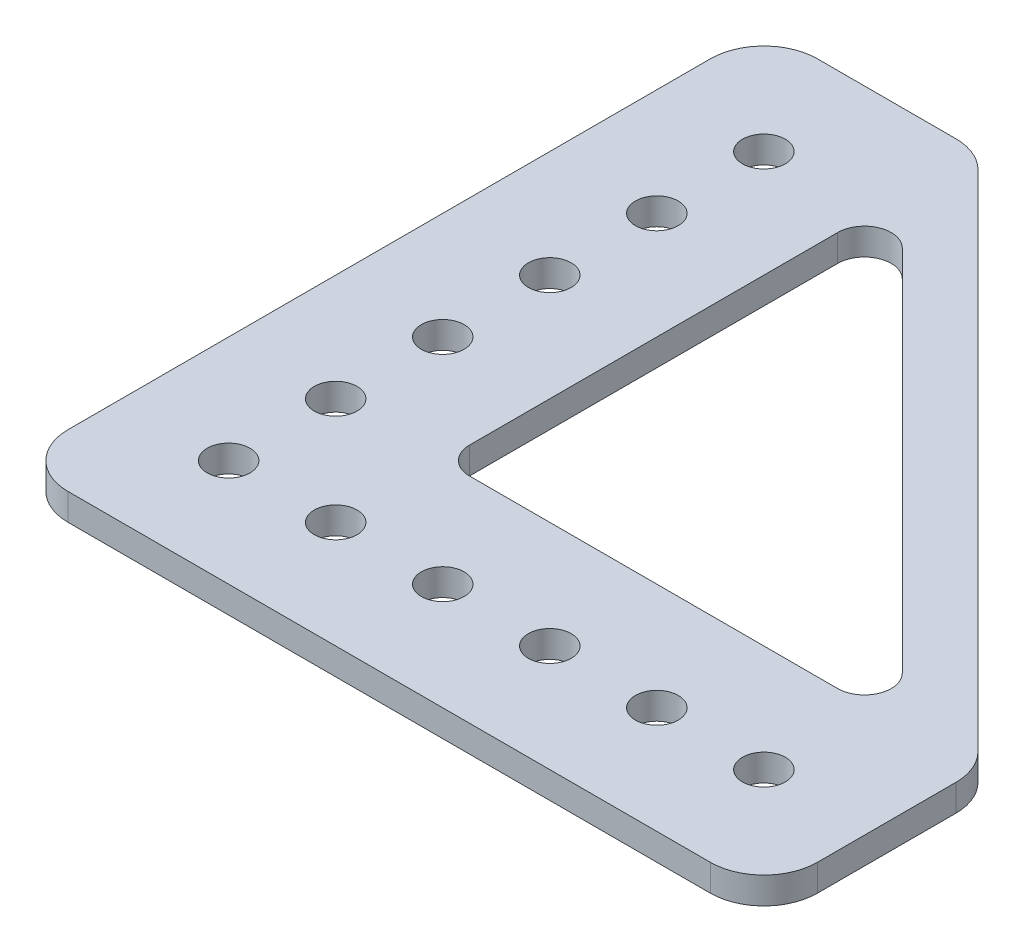
from build123d import *

# Parameters (mm, degrees)
SKETCH1_R           = 2.54
BOSS_EXTRUDE1_DEPTH = 3.175
FILLET1_R           = 6.35
FILLET2_R           = 3.175


with BuildPart() as part:
    # Sketch1 → Boss-Extrude1 (new body)
    with BuildSketch(Plane(origin=(0, 0, 0), x_dir=(1, 0, 0), z_dir=(0, 1, 0))):
        Polygon((0, 0), (0, 88.9), (25.4, 88.9), (88.9, 25.4), (88.9, 0), align=None)
        with Locations(Location((12.7, 12.7, 0), (0, 0, 270))):
            Circle(SKETCH1_R, mode=Mode.SUBTRACT)
        with Locations(Location((25.4, 12.7, 0), (0, 0, 270))):
            Circle(SKETCH1_R, mode=Mode.SUBTRACT)
        with Locations(Location((38.1, 12.7, 0), (0, 0, 270))):
            Circle(SKETCH1_R, mode=Mode.SUBTRACT)
        with Locations(Location((50.8, 12.7, 0), (0, 0, 270))):
            Circle(SKETCH1_R, mode=Mode.SUBTRACT)
        with Locations(Location((63.5, 12.7, 0), (0, 0, 270))):
            Circle(SKETCH1_R, mode=Mode.SUBTRACT)
        with Locations(Location((76.2, 12.7, 0), (0, 0, 270))):
            Circle(SKETCH1_R, mode=Mode.SUBTRACT)
        with Locations(Location((12.7, 25.4, 0), (0, 0, 270))):
            Circle(SKETCH1_R, mode=Mode.SUBTRACT)
        with Locations(Location((12.7, 38.1, 0), (0, 0, 270))):
            Circle(SKETCH1_R, mode=Mode.SUBTRACT)
        with Locations(Location((12.7, 50.8, 0), (0, 0, 270))):
            Circle(SKETCH1_R, mode=Mode.SUBTRACT)
        with Locations(Location((12.7, 63.5, 0), (0, 0, 270))):
            Circle(SKETCH1_R, mode=Mode.SUBTRACT)
        with Locations(Location((12.7, 76.2, 0), (0, 0, 270))):
            Circle(SKETCH1_R, mode=Mode.SUBTRACT)
        Polygon((25.4, 25.4), (25.4, 79.919743879), (79.919743879, 25.4), align=None, mode=Mode.SUBTRACT)
    extrude(amount=BOSS_EXTRUDE1_DEPTH)

    # Fillet1
    fillet1_edges = [part.edges().sort_by_distance(p)[0] for p in [
        (0, 1.5875, 0),
        (0, 1.5875, -88.9),
        (25.4, 1.5875, -88.9),
        (88.9, 1.5875, -25.4),
        (88.9, 1.5875, 0),
    ]]
    fillet(fillet1_edges, radius=FILLET1_R)

    # Fillet2
    fillet2_edges = [part.edges().sort_by_distance(p)[0] for p in [
        (25.4, 1.5875, -25.4),
        (79.919743879, 1.5875, -25.4),
        (25.4, 1.5875, -79.919743879),
    ]]
    fillet(fillet2_edges, radius=FILLET2_R)


solid = part.part
